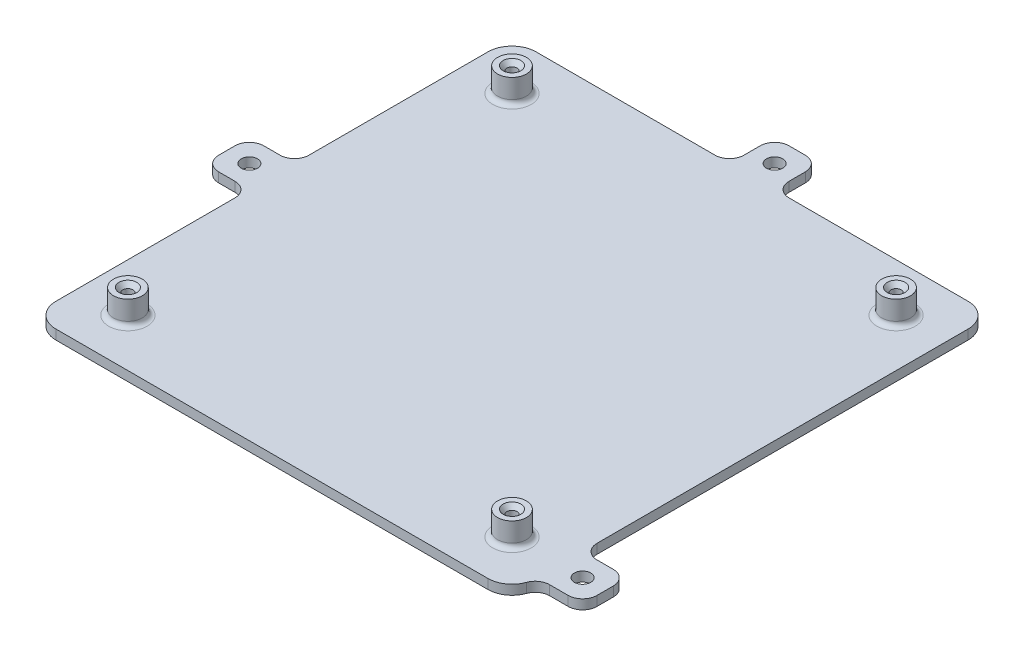
from build123d import *
from OCP.BRepFilletAPI import BRepFilletAPI_MakeChamfer

# Parameters (mm, degrees)
SKIZZE1_W                       = 100
SKIZZE1_H                       = 100
SKIZZE1_R                       = 1.05
AUFSATZ_LINEAR_AUSTRAGEN1_DEPTH = 2
SKIZZE2_R                       = 3
SKIZZE2_R_2                     = 1.05
AUFSATZ_LINEAR_AUSTRAGEN2_DEPTH = 5
VERRUNDUNG1_R                   = 1
FASE1_SIZE                      = 0.8
FASE1_SIZE2                     = 0.953402874
VERRUNDUNG2_R                   = 5
SKIZZE3_W                       = 9.4
SKIZZE3_H                       = 9.4
SKIZZE3_R                       = 1.7
AUFSATZ_LINEAR_AUSTRAGEN3_DEPTH = 2
VERRUNDUNG3_R                   = 3
SKIZZE4_W                       = 9.4
SKIZZE4_H                       = 9.4
SKIZZE4_R                       = 1.7
AUFSATZ_LINEAR_AUSTRAGEN4_DEPTH = 2
VERRUNDUNG4_R                   = 3


with BuildPart() as part:
    # Skizze1 → Aufsatz-Linear austragen1 (new body)
    with BuildSketch(Plane(origin=(0, 0, 0), x_dir=(1, 0, 0), z_dir=(0, 1, 0))):
        with Locations((40, -40)):
            Rectangle(SKIZZE1_W, SKIZZE1_H)
        with Locations(Location((0, 0, 0), (0, 0, 270))):
            Circle(SKIZZE1_R, mode=Mode.SUBTRACT)
        with Locations(Location((0, -80, 0), (0, 0, 270))):
            Circle(SKIZZE1_R, mode=Mode.SUBTRACT)
        with Locations(Location((80, 0, 0), (0, 0, 270))):
            Circle(SKIZZE1_R, mode=Mode.SUBTRACT)
        with Locations(Location((80, -80, 0), (0, 0, 270))):
            Circle(SKIZZE1_R, mode=Mode.SUBTRACT)
    extrude(amount=AUFSATZ_LINEAR_AUSTRAGEN1_DEPTH)

    # Skizze2 → Aufsatz-Linear austragen2 (add)
    # profile 1 of 4: a face of its own
    with BuildSketch(Plane(origin=(0, 2, 0), x_dir=(1, 0, 0), z_dir=(0, 1, 0))):
        with Locations(Location((0, 0, 0), (0, 0, 270))):
            Circle(SKIZZE2_R)
        with Locations(Location((0, 0, 0), (0, 0, 270))):
            Circle(SKIZZE2_R_2, mode=Mode.SUBTRACT)
    # profile 2 of 4: a face of its own
    with BuildSketch(Plane(origin=(0, 2, 0), x_dir=(1, 0, 0), z_dir=(0, 1, 0))):
        with Locations(Location((80, 0, 0), (0, 0, 270))):
            Circle(SKIZZE2_R)
        with Locations(Location((80, 0, 0), (0, 0, 270))):
            Circle(SKIZZE2_R_2, mode=Mode.SUBTRACT)
    # profile 3 of 4: a face of its own
    with BuildSketch(Plane(origin=(0, 2, 0), x_dir=(1, 0, 0), z_dir=(0, 1, 0))):
        with Locations(Location((0, -80, 0), (0, 0, 270))):
            Circle(SKIZZE2_R)
        with Locations(Location((0, -80, 0), (0, 0, 270))):
            Circle(SKIZZE2_R_2, mode=Mode.SUBTRACT)
    # profile 4 of 4: a face of its own
    with BuildSketch(Plane(origin=(0, 2, 0), x_dir=(1, 0, 0), z_dir=(0, 1, 0))):
        with Locations(Location((80, -80, 0), (0, 0, 270))):
            Circle(SKIZZE2_R)
        with Locations(Location((80, -80, 0), (0, 0, 270))):
            Circle(SKIZZE2_R_2, mode=Mode.SUBTRACT)
    extrude(amount=AUFSATZ_LINEAR_AUSTRAGEN2_DEPTH)

    # Verrundung1
    verrundung1_edges = [part.edges().sort_by_distance(p)[0] for p in [
        (0, 2, -3),
        (80, 2, -3),
        (0, 2, 77),
        (80, 2, 77),
    ]]
    fillet(verrundung1_edges, radius=VERRUNDUNG1_R)

    # Fase1: one chamfer whose edges measure the first distance from different faces: ONE call of the kernel's chamfer builder (chamfer() names one face for all edges)
    fase1_edges_1 = [part.edges().sort_by_distance(p)[0] for p in [
        (80, 0, 78.95),
    ]]
    fase1_side_1 = [part.faces().sort_by_distance(p)[0] for p in [
        (80, 3.5, 78.95),
    ]]
    fase1_edges_2 = [part.edges().sort_by_distance(p)[0] for p in [
        (0, 7, -1.05),
    ]]
    fase1_side_2 = [part.faces().sort_by_distance(p)[0] for p in [
        (0, 7, -2.915147186),
    ]]
    fase1_edges_3 = [part.edges().sort_by_distance(p)[0] for p in [
        (80, 7, -1.05),
    ]]
    fase1_side_3 = [part.faces().sort_by_distance(p)[0] for p in [
        (80, 7, -2.915147186),
    ]]
    fase1_edges_4 = [part.edges().sort_by_distance(p)[0] for p in [
        (0, 7, 78.95),
    ]]
    fase1_side_4 = [part.faces().sort_by_distance(p)[0] for p in [
        (0, 7, 77.084852814),
    ]]
    fase1_edges_5 = [part.edges().sort_by_distance(p)[0] for p in [
        (80, 7, 78.95),
    ]]
    fase1_side_5 = [part.faces().sort_by_distance(p)[0] for p in [
        (80, 7, 77.084852814),
    ]]
    fase1 = BRepFilletAPI_MakeChamfer(part.part.solid().wrapped)
    for e in fase1_edges_1:
        fase1.Add(FASE1_SIZE, FASE1_SIZE2, e.wrapped, fase1_side_1[0].wrapped)  # the first distance lies on this face
    for e in fase1_edges_2:
        fase1.Add(FASE1_SIZE, FASE1_SIZE2, e.wrapped, fase1_side_2[0].wrapped)  # the first distance lies on this face
    for e in fase1_edges_3:
        fase1.Add(FASE1_SIZE, FASE1_SIZE2, e.wrapped, fase1_side_3[0].wrapped)  # the first distance lies on this face
    for e in fase1_edges_4:
        fase1.Add(FASE1_SIZE, FASE1_SIZE2, e.wrapped, fase1_side_4[0].wrapped)  # the first distance lies on this face
    for e in fase1_edges_5:
        fase1.Add(FASE1_SIZE, FASE1_SIZE2, e.wrapped, fase1_side_5[0].wrapped)  # the first distance lies on this face
    add(Compound.cast(fase1.Shape()), mode=Mode.REPLACE)

    # Verrundung2
    verrundung2_edges = [part.edges().sort_by_distance(p)[0] for p in [
        (-10, 1, -10),
        (90, 1, -10),
        (90, 1, 90),
        (-10, 1, 90),
    ]]
    fillet(verrundung2_edges, radius=VERRUNDUNG2_R)

    # Skizze3 → Aufsatz-Linear austragen3 (add)
    # profile 1 of 2: a face of its own
    with BuildSketch(Plane(origin=(0, 2, 0), x_dir=(1, 0, 0), z_dir=(0, 1, 0))):
        with Locations((-14.7, -40)):
            Rectangle(SKIZZE3_W, SKIZZE3_H)
        with Locations(Location((-14.7, -40, 0), (0, 0, 270))):
            Circle(SKIZZE3_R, mode=Mode.SUBTRACT)
    # profile 2 of 2: a face of its own
    with BuildSketch(Plane(origin=(0, 2, 0), x_dir=(1, 0, 0), z_dir=(0, 1, 0))):
        with Locations((94.7, -80)):
            Rectangle(SKIZZE3_W, SKIZZE3_H)
        with Locations(Location((94.7, -80, 0), (0, 0, 270))):
            Circle(SKIZZE3_R, mode=Mode.SUBTRACT)
    extrude(amount=-AUFSATZ_LINEAR_AUSTRAGEN3_DEPTH)

    # Verrundung3
    verrundung3_edges = [part.edges().sort_by_distance(p)[0] for p in [
        (90, 1, 84.7),
        (99.4, 1, 84.7),
        (99.4, 1, 75.3),
        (90, 1, 75.3),
        (-10, 1, 35.3),
        (-10, 1, 44.7),
        (-19.4, 1, 44.7),
        (-19.4, 1, 35.3),
    ]]
    fillet(verrundung3_edges, radius=VERRUNDUNG3_R)

    # Skizze4 → Aufsatz-Linear austragen4 (add)
    with BuildSketch(Plane(origin=(0, 2, 0), x_dir=(1, 0, 0), z_dir=(0, 1, 0))):
        with Locations((40, 14.7)):
            Rectangle(SKIZZE4_W, SKIZZE4_H)
        with Locations(Location((40, 14.7, 0), (0, 0, 270))):
            Circle(SKIZZE4_R, mode=Mode.SUBTRACT)
    extrude(amount=-AUFSATZ_LINEAR_AUSTRAGEN4_DEPTH)

    # Verrundung4
    verrundung4_edges = [part.edges().sort_by_distance(p)[0] for p in [
        (44.7, 1, -10),
        (44.7, 1, -19.4),
        (35.3, 1, -19.4),
        (35.3, 1, -10),
    ]]
    fillet(verrundung4_edges, radius=VERRUNDUNG4_R)


solid = part.part
